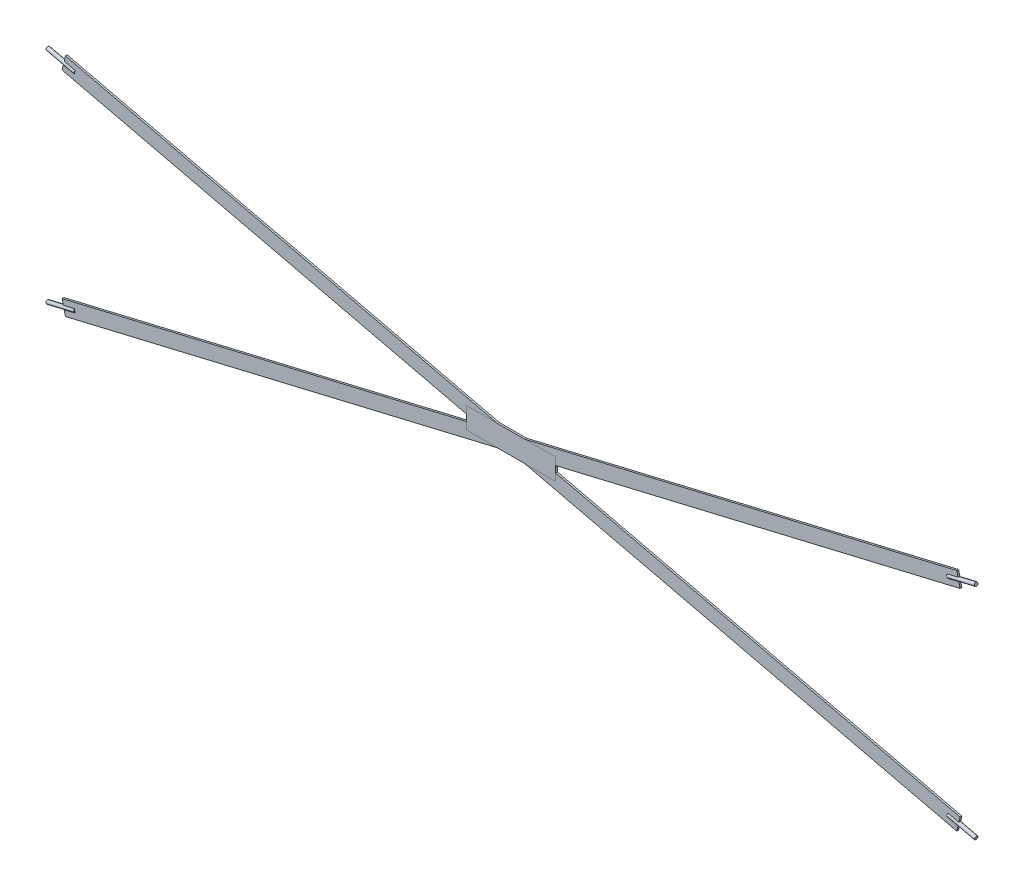
from build123d import *

# Parameters (mm, degrees)
BOSS_EXTRUDE1_DEPTH   = 5
BOSS_EXTRUDE2_DEPTH   = 5
BOSS_EXTRUDE2_2_DEPTH = 5
BOSS_EXTRUDE2_3_DEPTH = 5
BOSS_EXTRUDE2_4_DEPTH = 5
CUT_EXTRUDE1_DEPTH    = 2594.163932788
SKETCH4_R             = 10
BOSS_EXTRUDE4_DEPTH   = 160
MIRROR2_COPY_1_DEPTH  = 2594.163932788


with BuildPart() as part:
    # Sketch1 → Boss-Extrude1 (new, symmetric)
    with BuildSketch(Plane.XY):
        Polygon((-250, 59.189646289), (0, 0), (250, 59.189646289), align=None)
        Polygon((0, 0), (250, -59.189646289), (250, 59.189646289), align=None)
        Polygon((-250, -59.189646289), (250, -59.189646289), (0, 0), align=None)
        Polygon((-250, -59.189646289), (0, 0), (-250, 59.189646289), align=None)
    extrude(amount=BOSS_EXTRUDE1_DEPTH, both=True)


with BuildPart() as body_2:
    # Sketch2 → Boss-Extrude2 (new, symmetric)
    with BuildSketch(Plane.XY):
        Polygon((250, 18.083838862), (250, 59.189646289), (76.380921308, 59.189646289), (2496.47691812, 632.168150433), (2514.908072255, 554.320269555), align=None)
    extrude(amount=BOSS_EXTRUDE2_DEPTH, both=True)

    # Sketch3 → Cut-Extrude1 (cut, symmetric)
    with BuildSketch(Plane.XY.offset(5)):
        Polygon((2602.179840983, 605.811965613), (2446.484079226, 568.949657345), (2441.876290693, 588.411627565), (2597.57205245, 625.273935833), align=None)
    cut_extrude1 = extrude(amount=CUT_EXTRUDE1_DEPTH, both=True, mode=Mode.SUBTRACT)


with BuildPart() as body_3:
    # Sketch2 → Boss-Extrude2 2 (new, symmetric)
    with BuildSketch(Plane.XY):
        Polygon((-2514.908072255, 554.320269555), (-2496.47691812, 632.168150433), (-76.380921308, 59.189646289), (-250, 59.189646289), (-250, 18.083838862), align=None)
    extrude(amount=BOSS_EXTRUDE2_2_DEPTH, both=True)

    # Mirror1: Cut-Extrude1 across plane
    add(cut_extrude1.mirror(Plane(origin=(0, 0, 0), x_dir=(0, 0, 1), z_dir=(1, 0, 0))), mode=Mode.SUBTRACT)


with BuildPart() as body_4:
    # Sketch2 → Boss-Extrude2 3 (new, symmetric)
    with BuildSketch(Plane.XY):
        Polygon((-250, -18.083838862), (-250, -59.189646289), (-76.380921308, -59.189646289), (-2496.47691812, -632.168150433), (-2514.908072255, -554.320269555), align=None)
    extrude(amount=BOSS_EXTRUDE2_3_DEPTH, both=True)

    # Mirror2 copy 1 sketch → Mirror2 copy 1 (cut, symmetric)
    with BuildSketch(Plane(origin=(0, 0, 5), x_dir=(-1, 0, 0), z_dir=(0, 0, 1))):
        Polygon((2602.179840983, 605.811965613), (2446.484079226, 568.949657345), (2441.876290693, 588.411627565), (2597.57205245, 625.273935833), align=None)
    extrude(amount=MIRROR2_COPY_1_DEPTH, both=True, mode=Mode.SUBTRACT)


with BuildPart() as body_5:
    # Sketch2 → Boss-Extrude2 4 (new, symmetric)
    with BuildSketch(Plane.XY):
        Polygon((2514.908072255, -554.320269555), (2496.47691812, -632.168150433), (76.380921308, -59.189646289), (250, -59.189646289), (250, -18.083838862), align=None)
    extrude(amount=BOSS_EXTRUDE2_4_DEPTH, both=True)

    # Mirror2: Cut-Extrude1 across plane
    add(cut_extrude1.mirror(Plane.ZX), mode=Mode.SUBTRACT)


with BuildPart() as body_6:
    # Sketch4 → Boss-Extrude4 (new body)
    with BuildSketch(Plane(origin=(2444.180184959, 578.680642455, 0), x_dir=(0, 0, -1), z_dir=(0.9730985109821265, 0.23038942667659104, 0))):
        with Locations(Location((0, 0, 0), (0, 0, 90))):
            Circle(SKETCH4_R)
    extrude(amount=BOSS_EXTRUDE4_DEPTH)


with BuildPart() as body_7:
    # Mirror3: mirrored copy
    add(body_6.part.mirror(Plane(origin=(0, 0, 0), x_dir=(0, 0, 1), z_dir=(1, 0, 0))))


with BuildPart() as body_8:
    # Mirror4: mirrored copy
    add(body_6.part.mirror(Plane.ZX))


with BuildPart() as body_9:
    # Mirror4 2: mirrored copy
    add(body_7.part.mirror(Plane.ZX))


solid = Compound([part.part, body_2.part, body_3.part, body_4.part, body_5.part, body_6.part, body_7.part, body_8.part, body_9.part])
